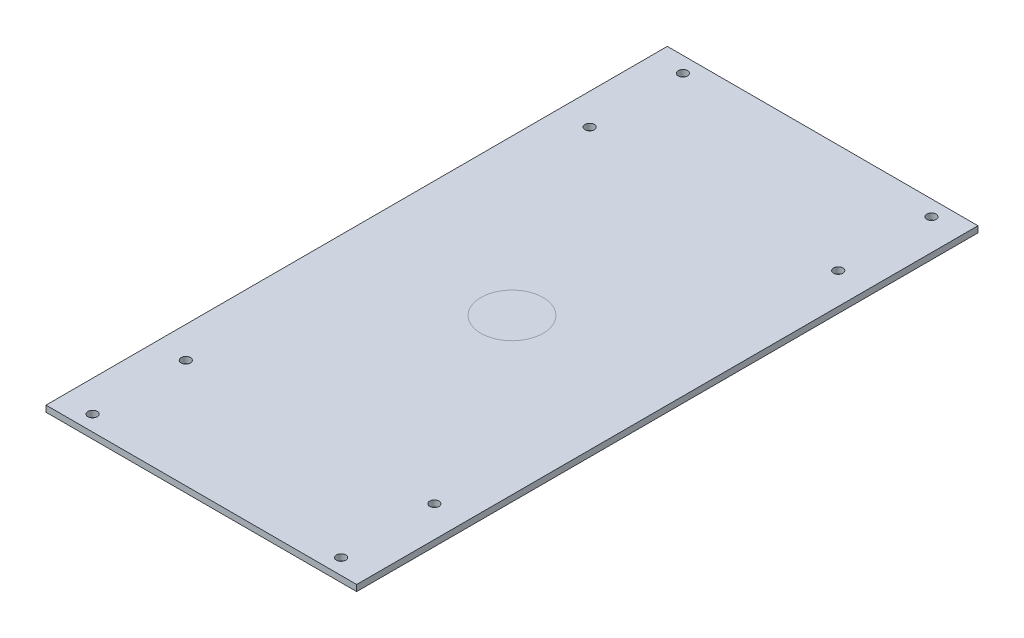
from build123d import *

# Parameters (mm, degrees)
SKETCH1_W             = 100
SKETCH1_H             = 200
BOSS_EXTRUDE1_DEPTH   = 2
F_3_0MM_DOWEL_HOLE1_D = 3


with BuildPart() as part:
    # Sketch1 → Boss-Extrude1 (new body)
    with BuildSketch(Plane(origin=(0, 0, 0), x_dir=(1, 0, 0), z_dir=(0, 1, 0))):
        Rectangle(SKETCH1_W, SKETCH1_H)
    extrude(amount=BOSS_EXTRUDE1_DEPTH)

    # Ø3.0mm Dowel Hole1 (through all)
    with Locations(Plane(origin=(0, 2, 0), x_dir=(1, 0, 0), z_dir=(0, 1, 0))):
        with Locations((-40, 95), (40, 95), (-40, 65), (40, 65), (-40, -65), (-40, -95), (40, -65), (40, -95)):
            Hole(F_3_0MM_DOWEL_HOLE1_D / 2)


solid = part.part
